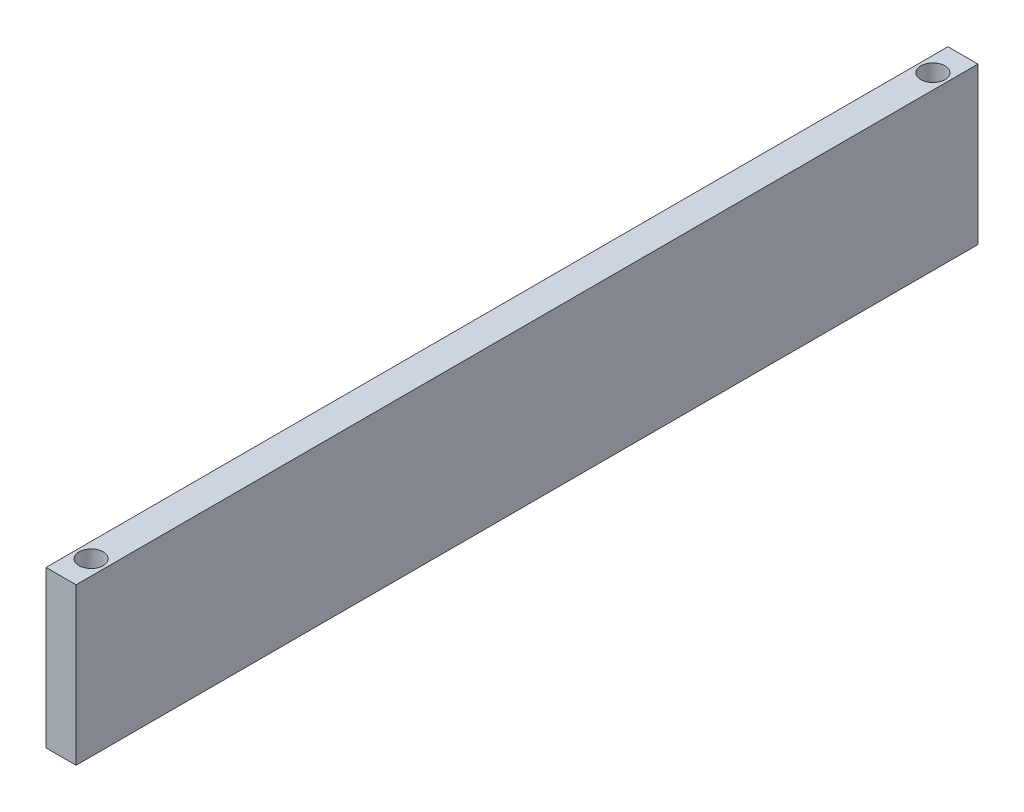
from build123d import *

# Parameters (mm, degrees)
SKETCH1_W           = 6.35
SKETCH1_H           = 33.02
BOSS_EXTRUDE1_DEPTH = 190.5
SKETCH3_R           = 2.54
CUT_EXTRUDE2_DEPTH  = 194.444805823


with BuildPart() as part:
    # Sketch1 → Boss-Extrude1 (new body)
    with BuildSketch(Plane.XY):
        with Locations((-3.175, 16.51)):
            Rectangle(SKETCH1_W, SKETCH1_H)
    extrude(amount=-BOSS_EXTRUDE1_DEPTH)

    # Sketch3 → Cut-Extrude2 (cut, through all)
    with BuildSketch(Plane(origin=(0, 33.02, 0), x_dir=(1, 0, 0), z_dir=(0, 1, 0))):
        with Locations(Location((-3.175, 6.35, 0), (0, 0, 270))):
            Circle(SKETCH3_R)
        with Locations(Location((-3.175, 184.15, 0), (0, 0, 270))):
            Circle(SKETCH3_R)
    extrude(amount=-CUT_EXTRUDE2_DEPTH, mode=Mode.SUBTRACT)


solid = part.part
